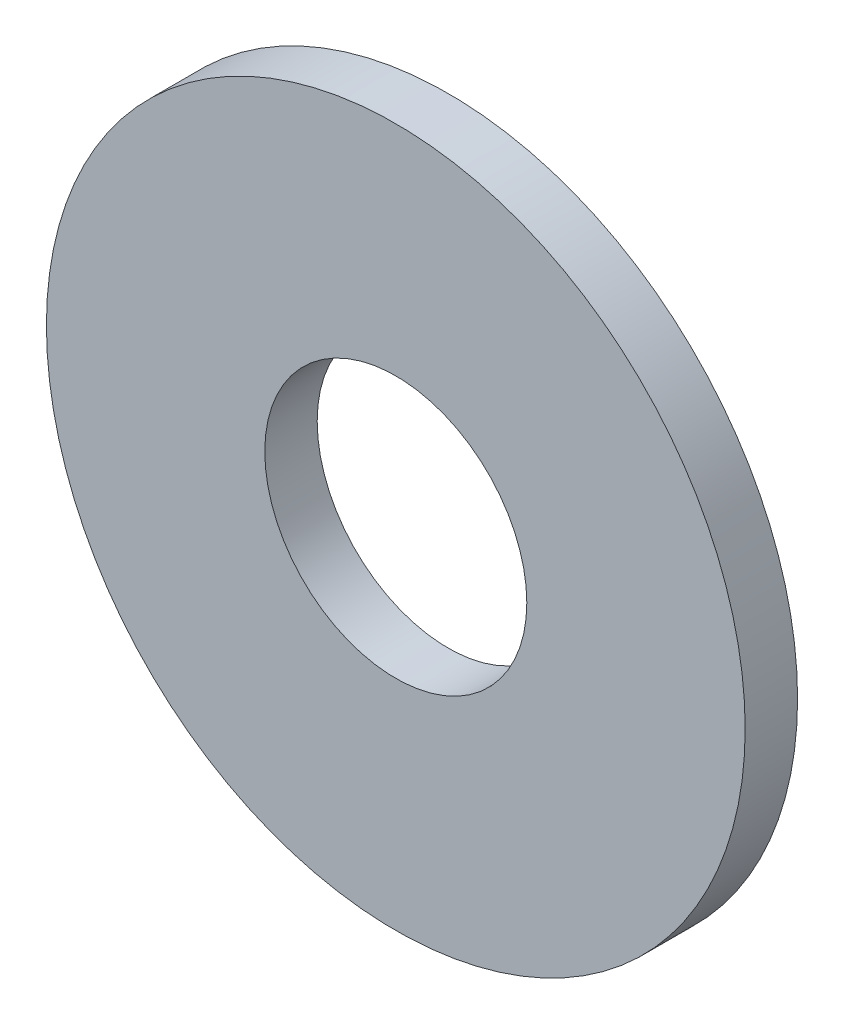
from build123d import *

# Parameters (mm, degrees)
SKETCH_1_R          = 2
EXTRUDE_178_DEPTH   = 0.3
SKETCH_2_R          = 0.75
CUT_EXTRUDE_1_DEPTH = 3.844292531


with BuildPart() as part:
    # Эскиз1 → Extrude 178 (new body)
    with BuildSketch(Plane.XY):
        Circle(SKETCH_1_R)
    extrude(amount=EXTRUDE_178_DEPTH)

    # Эскиз2 → Вырез-Вытянуть1 (cut, through all)
    with BuildSketch(Plane.XY.offset(0.3)):
        Circle(SKETCH_2_R)
    extrude(amount=-CUT_EXTRUDE_1_DEPTH, mode=Mode.SUBTRACT)


solid = part.part
